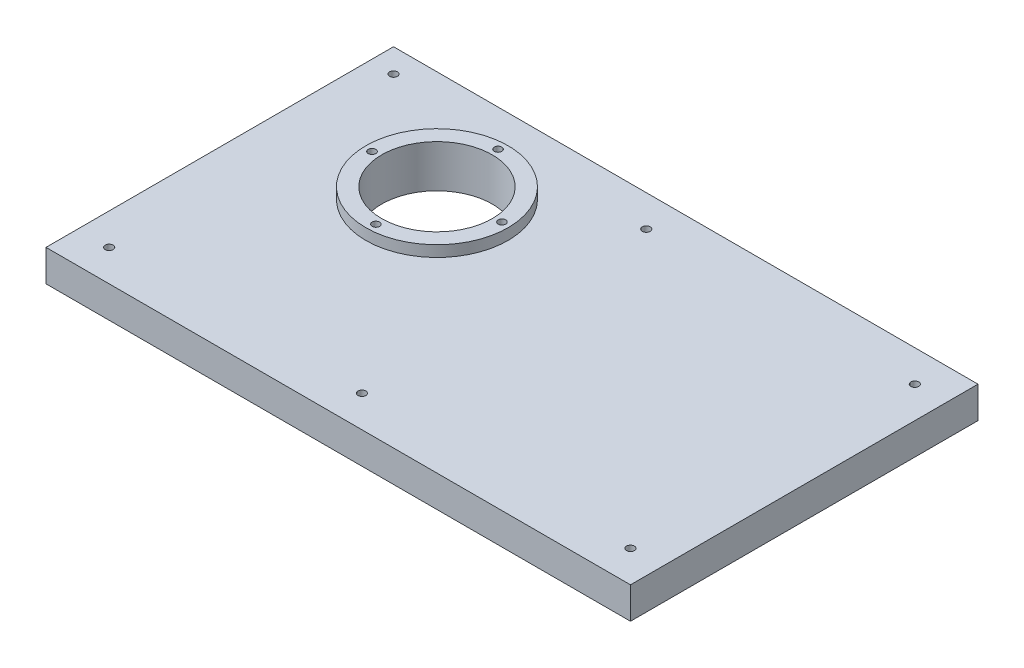
from build123d import *

# Parameters (mm, degrees)
SKETCH_2_W          = 370
SKETCH_2_H          = 220
EXTRUDE_1_DEPTH     = 20
SKETCH_3_R          = 2.5
CUT_EXTRUDE_1_DEPTH = 20
CUT_EXTRUDE_2_REACH = 423.551
SKETCH_4_R          = 35
SKETCH_5_R          = 45
EXTRUDE_2_DEPTH     = 7
SKETCH_6_R          = 35
CUT_EXTRUDE_3_DEPTH = 39
SKETCH_7_R          = 2.377872616
CUT_EXTRUDE_4_DEPTH = 39
CUT_EXTRUDE_5_DEPTH = 5


with BuildPart() as part:
    # 草图2 → 凸台-拉伸1 (new body)
    with BuildSketch(Plane(origin=(0, 0, 0), x_dir=(1, 0, 0), z_dir=(0, 1, 0))):
        with Locations((185, -91.010380349)):
            Rectangle(SKETCH_2_W, SKETCH_2_H)
    extrude(amount=EXTRUDE_1_DEPTH)

    # 草图3 → 切除-拉伸1 (cut)
    with BuildSketch(Plane(origin=(0, 20, 0), x_dir=(1, 0, 0), z_dir=(0, 1, 0))):
        with Locations(Location((15, 3.989619651, 0), (0, 0, 270))):
            Circle(SKETCH_3_R)
        with Locations(Location((20, -181.010380349, 0), (0, 0, 270))):
            Circle(SKETCH_3_R)
        with Locations(Location((350, -1.010380349, 0), (0, 0, 270))):
            Circle(SKETCH_3_R)
        with Locations(Location((350, -181.010380349, 0), (0, 0, 270))):
            Circle(SKETCH_3_R)
        with Locations(Location((180, -1.010380349, 0), (0, 0, 270))):
            Circle(SKETCH_3_R)
        with Locations(Location((180, -181.010380349, 0), (0, 0, 270))):
            Circle(SKETCH_3_R)
    extrude(amount=-CUT_EXTRUDE_1_DEPTH, mode=Mode.SUBTRACT)

    # 草图4 → 切除-拉伸2 (cut, up to next)
    with BuildSketch(Plane(origin=(0, 20, 0), x_dir=(1, 0, 0), z_dir=(0, 1, 0)), mode=Mode.PRIVATE) as cut_extrude_2_sk1:
        with Locations(Location((97.503107502, -51.010380349, 0), (0, 0, 270))):
            Circle(SKETCH_4_R)
    cut_extrude_2_tool1 = extrude(cut_extrude_2_sk1.sketch, amount=-CUT_EXTRUDE_2_REACH, mode=Mode.PRIVATE) & part.part
    add(cut_extrude_2_tool1.solids().sort_by_distance((97.503108, 20, 51.01038))[0], mode=Mode.SUBTRACT)

    # 草图5 → 凸台-拉伸2 (add)
    with BuildSketch(Plane(origin=(0, 20, 0), x_dir=(1, 0, 0), z_dir=(0, 1, 0))):
        with Locations(Location((97.503107502, -51.010380349, 0), (0, 0, 270))):
            Circle(SKETCH_5_R)
    extrude(amount=EXTRUDE_2_DEPTH)

    # 草图6 → 切除-拉伸3 (cut)
    with BuildSketch(Plane(origin=(0, 27, 0), x_dir=(1, 0, 0), z_dir=(0, 1, 0))):
        with Locations(Location((97.503107502, -51.010380349, 0), (0, 0, 270))):
            Circle(SKETCH_6_R)
    extrude(amount=-CUT_EXTRUDE_3_DEPTH, mode=Mode.SUBTRACT)

    # 草图7 → 切除-拉伸4 (cut)
    with BuildSketch(Plane(origin=(0, 27, 0), x_dir=(1, 0, 0), z_dir=(0, 1, 0))):
        with Locations(Location((96.273712382, -11.115523536, 0), (0, 0, 270))):
            Circle(SKETCH_7_R)
        with Locations(Location((137.397964314, -49.78098523, 0), (0, 0, 270))):
            Circle(SKETCH_7_R)
        with Locations(Location((98.732502621, -90.905237161, 0), (0, 0, 270))):
            Circle(SKETCH_7_R)
        with Locations(Location((57.608250689, -52.239775468, 0), (0, 0, 270))):
            Circle(SKETCH_7_R)
    extrude(amount=-CUT_EXTRUDE_4_DEPTH, mode=Mode.SUBTRACT)

    # 草图9 → 切除-拉伸5 (cut)
    with BuildSketch(Plane(origin=(0, 0, 0), x_dir=(-1, 0, 0), z_dir=(0, -1, 0))):
        with BuildLine():
            Line((-9.028166447, -196.169689035), (-360.428374593, -196.169689035))
            ThreePointArc((-360.428374593, -196.169689035), (-363.963908499, -194.705222941), (-365.428374593, -191.169689035))
            Line((-365.428374593, -191.169689035), (-365.428374593, 9.692387297))
            ThreePointArc((-365.428374593, 9.692387297), (-363.963908499, 13.227921203), (-360.428374593, 14.692387297))
            Line((-360.428374593, 14.692387297), (-9.028166447, 14.692387297))
            ThreePointArc((-9.028166447, 14.692387297), (-5.492632541, 13.227921203), (-4.028166447, 9.692387297))
            Line((-4.028166447, 9.692387297), (-4.028166447, -191.169689035))
            ThreePointArc((-4.028166447, -191.169689035), (-5.492632541, -194.705222941), (-9.028166447, -196.169689035))
        make_face()
        with BuildLine():
            Line((-12.832379165, -191.278558398), (-355.537243956, -191.278558398))
            ThreePointArc((-355.537243956, -191.278558398), (-359.072777862, -189.814092304), (-360.537243956, -186.278558398))
            Line((-360.537243956, -186.278558398), (-360.537243956, 4.257797701))
            ThreePointArc((-360.537243956, 4.257797701), (-359.072777862, 7.793331607), (-355.537243956, 9.257797701))
            Line((-355.537243956, 9.257797701), (-12.832379165, 9.257797701))
            ThreePointArc((-12.832379165, 9.257797701), (-9.296845259, 7.793331607), (-7.832379165, 4.257797701))
            Line((-7.832379165, 4.257797701), (-7.832379165, -186.278558398))
            ThreePointArc((-7.832379165, -186.278558398), (-9.296845259, -189.814092304), (-12.832379165, -191.278558398))
        make_face(mode=Mode.SUBTRACT)
    extrude(amount=-CUT_EXTRUDE_5_DEPTH, mode=Mode.SUBTRACT)


solid = part.part
